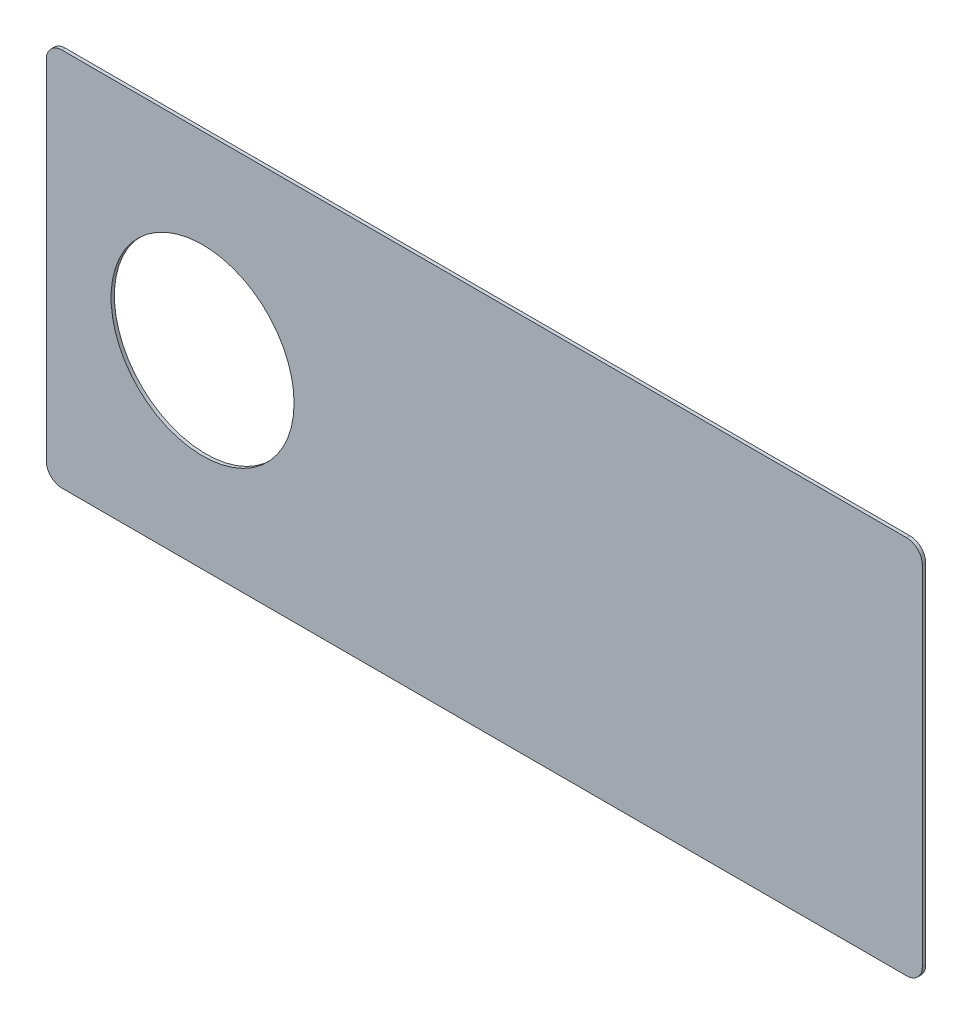
from build123d import *

# Parameters (mm, degrees)
EXTRUDE_START      = 300
EXTRUDE_SKETCH_1_R = 82
EXTRUDE_1_DEPTH    = 3


with BuildPart() as part:
    # Extrude sketch 1 → Extrude 1 (new body)
    with BuildSketch(Plane.XY.offset(EXTRUDE_START)):
        with BuildLine():
            Line((871, 170), (114, 170))
            ThreePointArc((114, 170), (104.100505063, 165.899494937), (100, 156))
            Line((100, 156), (100, -156))
            ThreePointArc((100, -156), (104.100505063, -165.899494937), (114, -170))
            Line((114, -170), (871, -170))
            ThreePointArc((871, -170), (880.899494937, -165.899494937), (885, -156))
            Line((885, -156), (885, 156))
            ThreePointArc((885, 156), (880.899494937, 165.899494937), (871, 170))
        make_face()
        with Locations((240, 0)):
            Circle(EXTRUDE_SKETCH_1_R, mode=Mode.SUBTRACT)
    extrude(amount=EXTRUDE_1_DEPTH)


solid = part.part
